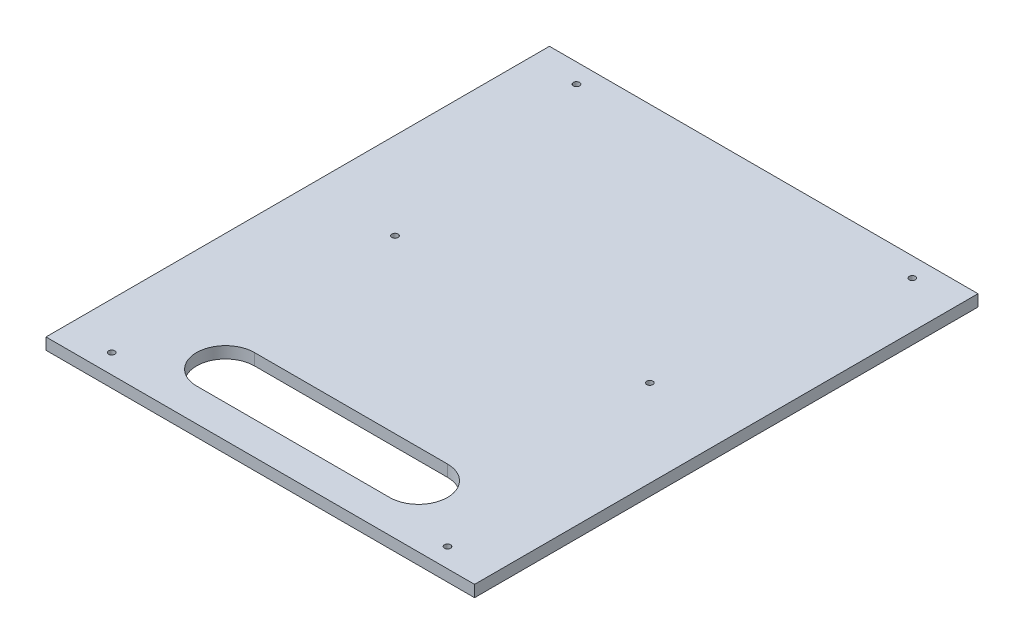
from build123d import *

# Parameters (mm, degrees)
BOSS_EXTRUDE1_DEPTH = 6
SKETCH3_R           = 1.6
SKETCH3_W           = 222
SKETCH3_H           = 30.425305758
CUT_EXTRUDE1_DEPTH  = 10
SKETCH4_R           = 1.6
CUT_EXTRUDE2_DEPTH  = 10
CUT_EXTRUDE3_DEPTH  = 10


with BuildPart() as part:
    # Sketch1 → Boss-Extrude1 (new body)
    with BuildSketch(Plane(origin=(0, 0, 0), x_dir=(1, 0, 0), z_dir=(0, 1, 0))):
        Polygon((-111, 125.612652879), (111, 125.612652879), (111, -125.612652879), (111, -165.612652879), (-111, -165.612652879), (-111, -125.612652879), align=None)
    extrude(amount=BOSS_EXTRUDE1_DEPTH)

    # Sketch3 → Cut-Extrude1 (cut)
    with BuildSketch(Plane.XZ):
        with Locations(Location((66, 29.812652879, 0), (0, 0, 270))):
            Circle(SKETCH3_R)
        with Locations(Location((-66, 29.812652879, 0), (0, 0, 270))):
            Circle(SKETCH3_R)
        with Locations((0, -110.4)):
            Rectangle(SKETCH3_W, SKETCH3_H)
    extrude(amount=-CUT_EXTRUDE1_DEPTH, mode=Mode.SUBTRACT)

    # Sketch4 → Cut-Extrude2 (cut)
    with BuildSketch(Plane.XZ):
        with Locations(Location((87, 155.612652879, 0), (0, 0, 270))):
            Circle(SKETCH4_R)
        with Locations(Location((-87, 155.612652879, 0), (0, 0, 270))):
            Circle(SKETCH4_R)
        with Locations(Location((87, -85.187347121, 0), (0, 0, 270))):
            Circle(SKETCH4_R)
        with Locations(Location((-87, -85.187347121, 0), (0, 0, 270))):
            Circle(SKETCH4_R)
    extrude(amount=-CUT_EXTRUDE2_DEPTH, mode=Mode.SUBTRACT)

    # Sketch5 → Cut-Extrude3 (cut)
    with BuildSketch(Plane(origin=(0, 6, 0), x_dir=(1, 0, 0), z_dir=(0, 1, 0))):
        with BuildLine():
            Line((-50, -118.612652879), (50, -118.612652879))
            ThreePointArc((50, -118.612652879), (65, -133.612652879), (50, -148.612652879))
            Line((50, -148.612652879), (-50, -148.612652879))
            ThreePointArc((-50, -148.612652879), (-65, -133.612652879), (-50, -118.612652879))
        make_face()
    extrude(amount=-CUT_EXTRUDE3_DEPTH, mode=Mode.SUBTRACT)


solid = part.part
